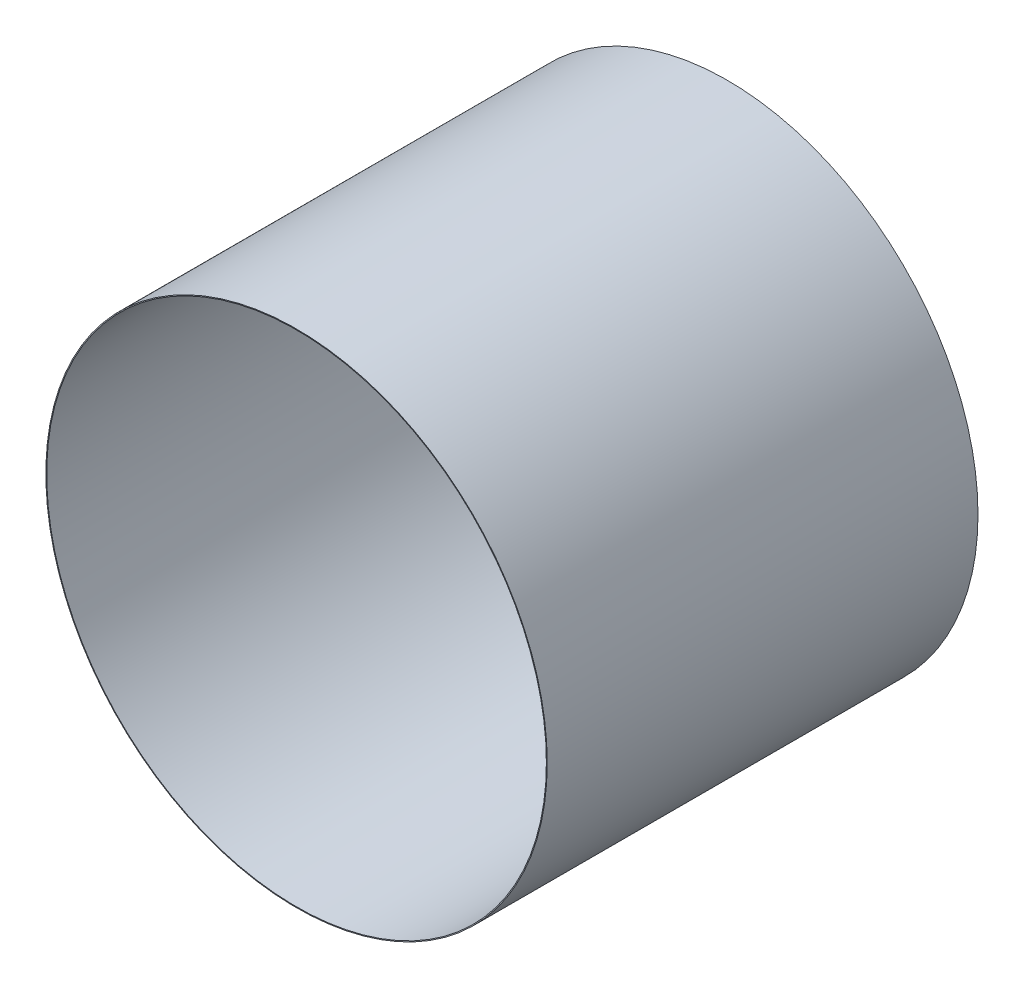
from build123d import *

# Parameters (mm, degrees)
SKETCH1_R           = 14.55
SKETCH1_R_2         = 14.5
BOSS_EXTRUDE1_DEPTH = 25


with BuildPart() as part:
    # Sketch1 → Boss-Extrude1 (new body)
    with BuildSketch(Plane.XY):
        Circle(SKETCH1_R)
        Circle(SKETCH1_R_2, mode=Mode.SUBTRACT)
    extrude(amount=BOSS_EXTRUDE1_DEPTH)


solid = part.part
